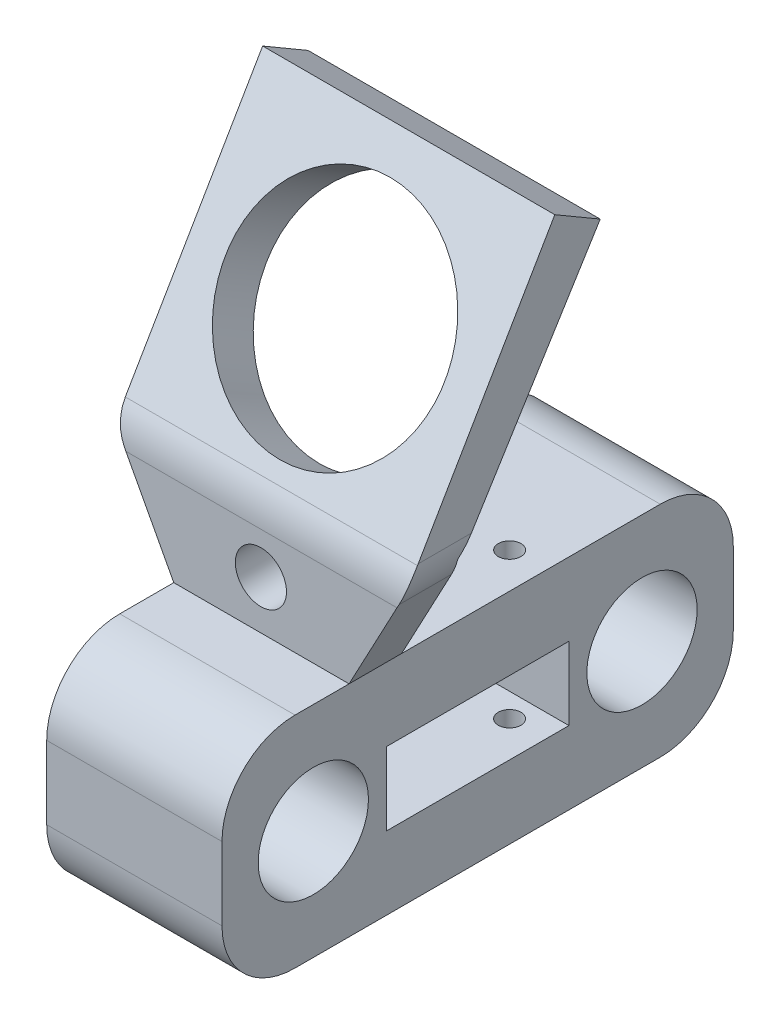
from build123d import *

# Parameters (mm, degrees)
SKETCH_1_W          = 24
SKETCH_1_H          = 70
EXTRUDE_1_DEPTH     = 30
SKETCH_2_R          = 7.55
CUT_EXTRUDE_1_DEPTH = 71.806439045
SKETCH_3_W          = 25
SKETCH_3_H          = 10
CUT_EXTRUDE_2_DEPTH = 71.806439045
FILLET_1_R          = 10
SKETCH_6_W          = 24
SKETCH_6_H          = 7.198600856
EXTRUDE_3_DEPTH     = 15
EXTRUDE_4_DEPTH     = 24
EXTRUDE_5_DEPTH     = 8
EXTRUDE_6_DEPTH     = 8
SKETCH_10_R         = 15
CUT_EXTRUDE_4_DEPTH = 16
EXTRUDE_7_DEPTH     = 7.198600855
EXTRUDE_8_DEPTH     = 7.198600855
FILLET_2_R          = 10
FILLET_3_R          = 10
SKETCH_14_R         = 3.499999999
CUT_EXTRUDE_5_DEPTH = 13
SKETCH_16_R         = 1.599999999
SKETCH_16_R_2       = 1.550452657
CUT_EXTRUDE_6_DEPTH = 26


with BuildPart() as part:
    # 草图1 → 凸台-拉伸1 (new body)
    with BuildSketch(Plane(origin=(0, 0, 0), x_dir=(1, 0, 0), z_dir=(0, 1, 0))):
        with Locations((20.241900648, -24.477321814)):
            Rectangle(SKETCH_1_W, SKETCH_1_H)
    extrude(amount=EXTRUDE_1_DEPTH)

    # 草图2 → 切除-拉伸1 (cut, through all)
    with BuildSketch(Plane(origin=(32.241900648, 0, 0), x_dir=(0, 0, -1), z_dir=(1, 0, 0))):
        with Locations((-46.977321814, 15)):
            Circle(SKETCH_2_R)
        with Locations((-1.977321814, 15)):
            Circle(SKETCH_2_R)
    extrude(amount=-CUT_EXTRUDE_1_DEPTH, mode=Mode.SUBTRACT)

    # 草图3 → 切除-拉伸2 (cut, through all)
    with BuildSketch(Plane(origin=(32.241900648, 0, 0), x_dir=(0, 0, -1), z_dir=(1, 0, 0))):
        with Locations((-24.477321814, 15)):
            Rectangle(SKETCH_3_W, SKETCH_3_H)
    extrude(amount=-CUT_EXTRUDE_2_DEPTH, mode=Mode.SUBTRACT)

    # 圆角1
    fillet_1_edges = [part.edges().sort_by_distance(p)[0] for p in [
        (20.241900648, 30, -10.522678186),
        (20.241900648, 0, -10.522678186),
        (20.241900648, 0, 59.477321814),
        (20.241900648, 30, 59.477321814),
    ]]
    fillet(fillet_1_edges, radius=FILLET_1_R)

    # 草图6 → 凸台-拉伸3 (add)
    with BuildSketch(Plane(origin=(0, 30, 0), x_dir=(1, 0, 0), z_dir=(0, 1, 0))):
        with Locations((20.241900648, -38.481509693)):
            Rectangle(SKETCH_6_W, SKETCH_6_H)
    extrude(amount=EXTRUDE_3_DEPTH)

    # 草图7 → 凸台-拉伸4 (add)
    with BuildSketch(Plane.ZY.offset(-8.241900648)):
        Polygon((42.080810121, 45), (21.912574503, 79.54333904), (15.694773475, 75.913056629), (34.882209265, 45), align=None)
    extrude(amount=-EXTRUDE_4_DEPTH)

    # 草图8 → 凸台-拉伸5 (add)
    with BuildSketch(Plane.ZY.offset(-8.241900648)):
        Polygon((42.080810121, 45), (34.882209265, 45), (15.694773475, 75.913056629), (21.912574503, 79.54333904), align=None)
    extrude(amount=EXTRUDE_5_DEPTH)

    # 草图9 → 凸台-拉伸6 (add)
    with BuildSketch(Plane(origin=(32.241900648, 0, 0), x_dir=(0, 0, -1), z_dir=(1, 0, 0))):
        Polygon((-42.080810121, 45), (-34.882209265, 45), (-15.694773475, 75.913056629), (-21.912574503, 79.54333904), align=None)
    extrude(amount=EXTRUDE_6_DEPTH)

    # 草图10 → 切除-拉伸4 (cut)
    with BuildSketch(Plane(origin=(0, 29.763050525, 50.976950321), x_dir=(1, 0, 0), z_dir=(0, 0.5042058904481267, 0.8635834760099408))):
        with Locations(Location((20.241900648, 37.643864083, 0), (0, 0, 270))):
            Circle(SKETCH_10_R)
    extrude(amount=-CUT_EXTRUDE_4_DEPTH, mode=Mode.SUBTRACT)

    # 草图12 → 凸台-拉伸7 (add)
    with BuildSketch(Plane.XY.offset(42.080810121)):
        Polygon((0.241900648, 45), (8.241900648, 45), (8.241900648, 30), align=None)
    extrude(amount=-EXTRUDE_7_DEPTH)

    # 草图13 → 凸台-拉伸8 (add)
    with BuildSketch(Plane.XY.offset(42.080810121)):
        Polygon((40.241900648, 45), (32.241900648, 45), (32.241900648, 30), align=None)
    extrude(amount=-EXTRUDE_8_DEPTH)

    # 圆角2
    fillet_2_edges = [part.edges().sort_by_distance(p)[0] for p in [
        (20.241900648, 45, 42.080810121),
    ]]
    fillet(fillet_2_edges, radius=FILLET_2_R)

    # 圆角3
    fillet_3_edges = [part.edges().sort_by_distance(p)[0] for p in [
        (0.241900648, 45, 38.295029227),
        (40.241900648, 45, 38.295029227),
    ]]
    fillet(fillet_3_edges, radius=FILLET_3_R)

    # 草图14 → 切除-拉伸5 (cut)
    with BuildSketch(Plane.XY.offset(42.080810121)):
        with Locations((20.170389916, 36.617139635)):
            Circle(SKETCH_14_R)
    extrude(amount=-CUT_EXTRUDE_5_DEPTH, mode=Mode.SUBTRACT)

    # 草图16 → 切除-拉伸6 (cut)
    with BuildSketch(Plane(origin=(0, 30, 0), x_dir=(1, 0, 0), z_dir=(0, 1, 0))):
        with Locations(Location((13.070026875, -15.228876714, 0), (0, 0, 270))):
            Circle(SKETCH_16_R)
        with Locations(Location((27.370026875, -15.228876714, 0), (0, 0, 270))):
            Circle(SKETCH_16_R_2)
    extrude(amount=-CUT_EXTRUDE_6_DEPTH, mode=Mode.SUBTRACT)


solid = part.part
